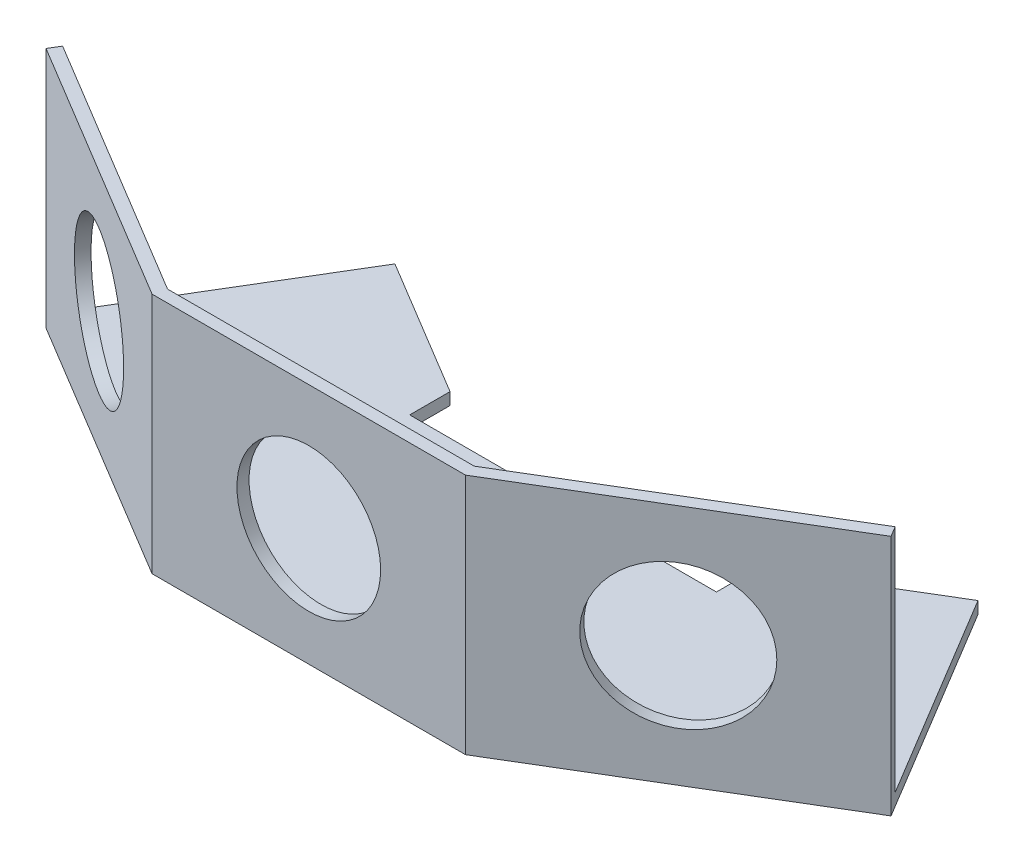
from build123d import *

# Parameters (mm, degrees)
SALIENTE_EXTRUIR1_DEPTH = 1.5
SALIENTE_EXTRUIR2_DEPTH = 30
CROQUIS3_R              = 8.9
CORTAR_EXTRUIR1_DEPTH   = 30
CROQUIS4_R              = 8.9
CORTAR_EXTRUIR2_DEPTH   = 30
CROQUIS5_R              = 8.9
CORTAR_EXTRUIR3_DEPTH   = 30


with BuildPart() as part:
    # Croquis1 → Saliente-Extruir1 (new body)
    with BuildSketch(Plane(origin=(0, 0, 0), x_dir=(1, 0, 0), z_dir=(0, 1, 0))):
        Polygon((-19, -15), (-51.571428571, 4.572992638), (-36.119065962, 30.287278353), (-19, 20), (-19, 15), (19, 15), (19, 20), (36.119065962, 30.287278353), (51.571428571, 4.572992638), (19, -15), align=None)
    extrude(amount=SALIENTE_EXTRUIR1_DEPTH)

    # Croquis2 → Saliente-Extruir2 (add)
    with BuildSketch(Plane(origin=(0, 0, 0), x_dir=(1, 0, 0), z_dir=(0, 1, 0))):
        Polygon((-51.571428571, 4.572992638), (-52.344046702, 3.287278353), (-19.416025147, -16.5), (19.416025147, -16.5), (52.344046702, 3.287278353), (51.571428571, 4.572992638), (19, -15), (-19, -15), align=None)
    extrude(amount=SALIENTE_EXTRUIR2_DEPTH)

    # Croquis3 → Cortar-Extruir1 (cut)
    with BuildSketch(Plane.XY.offset(16.5)):
        with Locations((0, 14.563888597)):
            Circle(CROQUIS3_R)
    extrude(amount=-CORTAR_EXTRUIR1_DEPTH, mode=Mode.SUBTRACT)

    # Croquis4 → Cortar-Extruir2 (cut)
    with BuildSketch(Plane(origin=(12.435875575, 0, 20.694547865), x_dir=(0.8571428571428564, 0, -0.5150787536377139), z_dir=(0.5150787536377139, 0, 0.8571428571428564))):
        with Locations((27.351520408, 15)):
            Circle(CROQUIS4_R)
    extrude(amount=-CORTAR_EXTRUIR2_DEPTH, mode=Mode.SUBTRACT)

    # Croquis5 → Cortar-Extruir3 (cut)
    with BuildSketch(Plane(origin=(-12.435875575, 0, 20.694547865), x_dir=(0.8571428571428567, 0, 0.5150787536377137), z_dir=(-0.5150787536377136, 0, 0.8571428571428565))):
        with Locations((-27.351520408, 15)):
            Circle(CROQUIS5_R)
    extrude(amount=-CORTAR_EXTRUIR3_DEPTH, mode=Mode.SUBTRACT)


solid = part.part
